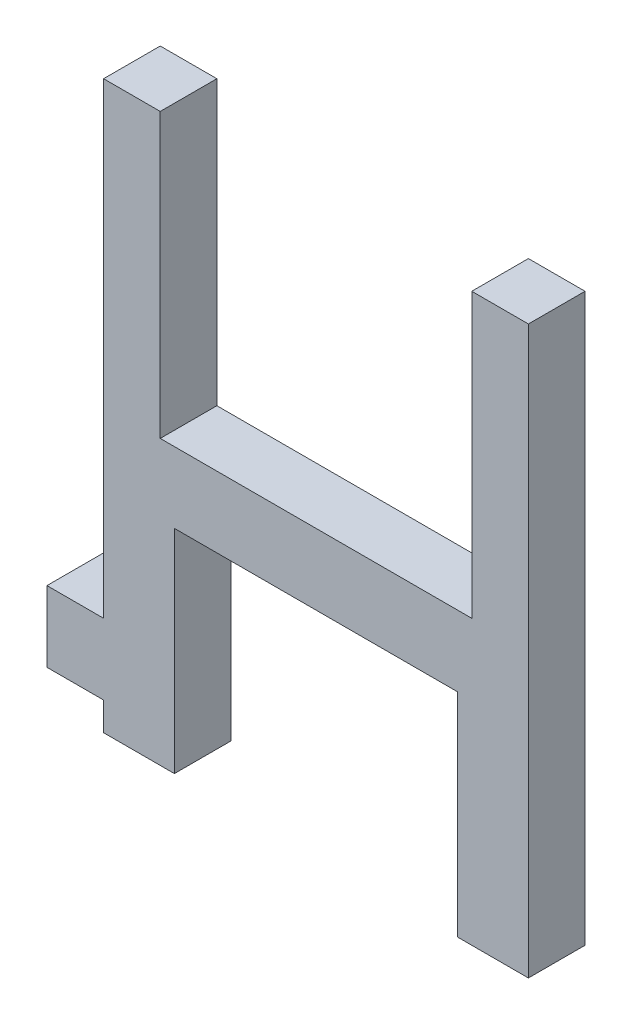
from build123d import *

# Parameters (mm, degrees)
P_IDAT_VYSUNUT_M1_DEPTH  = 4
SKICA2_W                 = 20
SKICA2_H                 = 4
P_IDAT_VYSUNUT_M2_DEPTH  = 15
SKICA3_W                 = 5.5
SKICA3_H                 = 3
ODEBRAT_VYSUNUT_M1_DEPTH = 15
SKICA4_W                 = 20
SKICA4_H                 = 15
ODEBRAT_VYSUNUT_M2_DEPTH = 15
SKICA5_W                 = 4
SKICA5_H                 = 4
P_IDAT_VYSUNUT_M3_DEPTH  = 20
SKICA6_W                 = 1
SKICA6_H                 = 5
ODEBRAT_VYSUNUT_M3_DEPTH = 10


with BuildPart() as part:
    # Skica1 → Přidat vysunutím1 (new body)
    with BuildSketch(Plane.XY):
        Polygon((0, 0), (5, 0), (5, -2), (10, -2), (10, 4.082474227), (10, 13), (30, 13), (30, -2), (35, -2), (35, 18), (5, 18), (5, 5), (0, 5), align=None)
    extrude(amount=P_IDAT_VYSUNUT_M1_DEPTH)

    # Skica2 → Přidat vysunutím2 (add)
    with BuildSketch(Plane(origin=(0, 18, 0), x_dir=(1, 0, 0), z_dir=(0, 1, 0))):
        with Locations((20, -2)):
            Rectangle(SKICA2_W, SKICA2_H)
    extrude(amount=P_IDAT_VYSUNUT_M2_DEPTH)

    # Skica3 → Odebrat vysunutím1 (cut)
    with BuildSketch(Plane.XY.offset(4)):
        with Locations((20, 28)):
            Rectangle(SKICA3_W, SKICA3_H)
    extrude(amount=-ODEBRAT_VYSUNUT_M1_DEPTH, mode=Mode.SUBTRACT)

    # Skica4 → Odebrat vysunutím2 (cut)
    with BuildSketch(Plane.XY.offset(4)):
        with Locations((20, 25.5)):
            Rectangle(SKICA4_W, SKICA4_H)
    extrude(amount=-ODEBRAT_VYSUNUT_M2_DEPTH, mode=Mode.SUBTRACT)

    # Skica5 → Přidat vysunutím3 (add)
    with BuildSketch(Plane(origin=(0, 18, 0), x_dir=(1, 0, 0), z_dir=(0, 1, 0))):
        with Locations((7, -2)):
            Rectangle(SKICA5_W, SKICA5_H)
        with Locations((33, -2)):
            Rectangle(SKICA5_W, SKICA5_H)
    extrude(amount=P_IDAT_VYSUNUT_M3_DEPTH)

    # Skica6 → Odebrat vysunutím3 (cut)
    with BuildSketch(Plane.XY.offset(4)):
        with Locations((0.5, 2.5)):
            Rectangle(SKICA6_W, SKICA6_H)
    extrude(amount=-ODEBRAT_VYSUNUT_M3_DEPTH, mode=Mode.SUBTRACT)


solid = part.part
